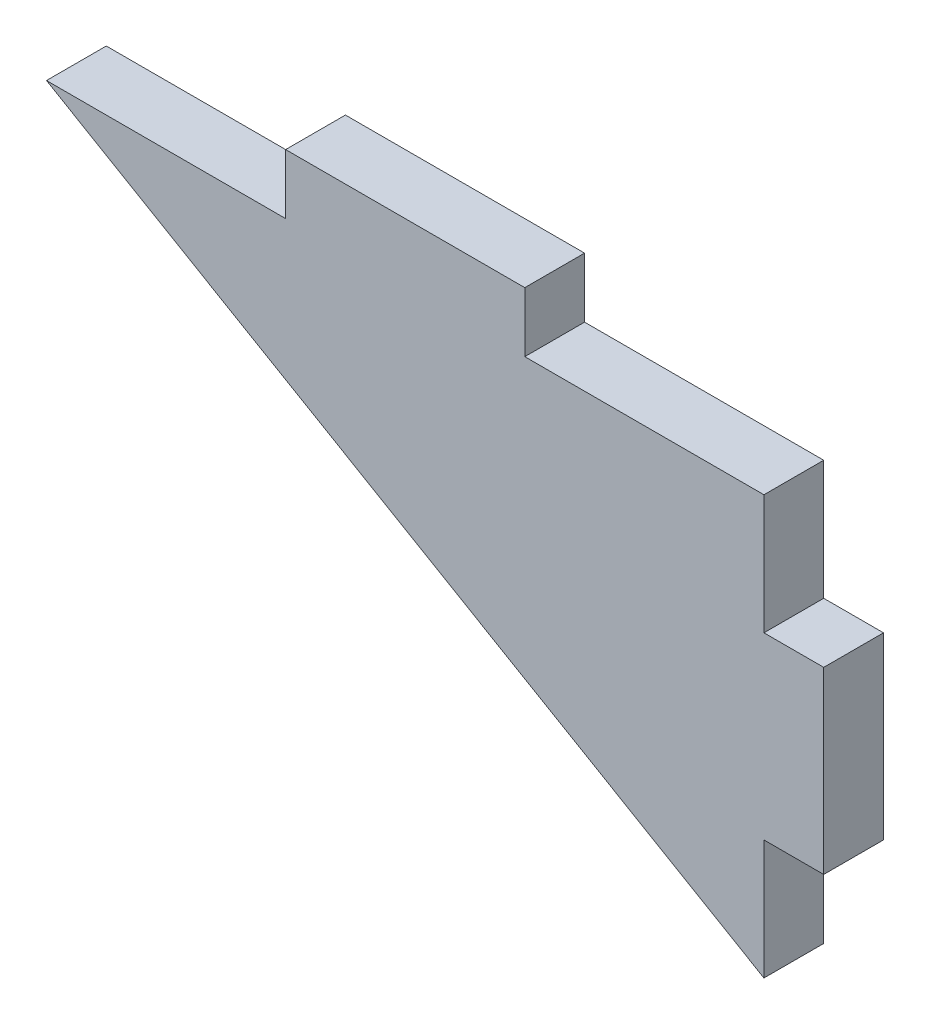
from build123d import *

# Parameters (mm, degrees)
EXTRUDE_1_DEPTH = 5


with BuildPart() as part:
    # 草图1 → 凸台-拉伸1 (new body)
    with BuildSketch(Plane.XY):
        Polygon((0, 0), (0, 10), (5, 10), (5, 25), (0, 25), (0, 35), (-20, 35), (-20, 40), (-40, 40), (-40, 35), (-60, 35), align=None)
    extrude(amount=EXTRUDE_1_DEPTH)


solid = part.part
